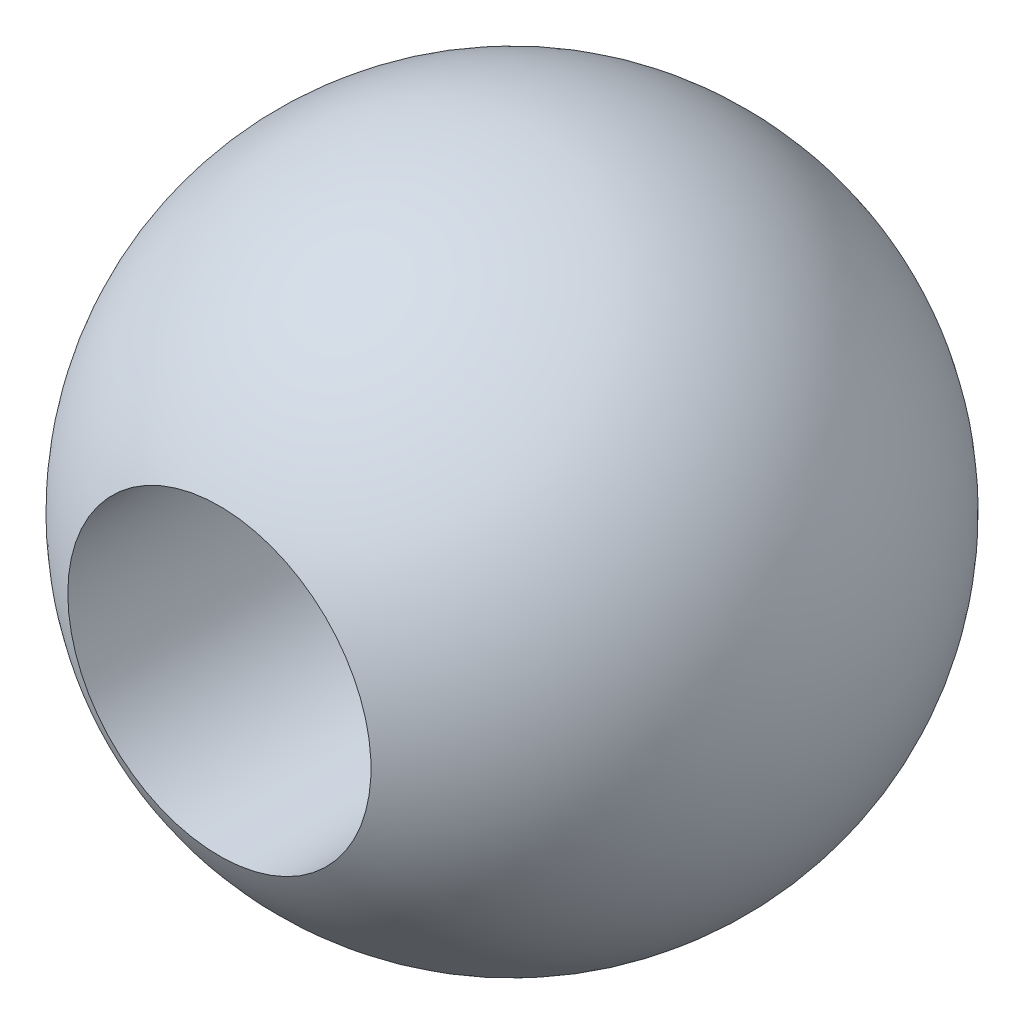
from build123d import *

# Parameters (mm, degrees)
SKETCH_2_R          = 1.15
CUT_EXTRUDE_1_DEPTH = 5


with BuildPart() as part:
    # 草图1 → 旋转1 (revolve)
    with BuildSketch(Plane.XY):
        with BuildLine():
            Line((0, 2.5), (0, -2.5))
            ThreePointArc((0, -2.5), (-2.5, 0), (0, 2.5))
        make_face()
    revolve(axis=Axis((0, 2.5, 0), (0, -1, 0)))

    # 草图2 → 切除-拉伸1 (cut, symmetric)
    with BuildSketch(Plane.XY):
        with Locations(Location((0, 0, 0), (0, 0, 180))):
            Circle(SKETCH_2_R)
    extrude(amount=CUT_EXTRUDE_1_DEPTH, both=True, mode=Mode.SUBTRACT)


solid = part.part
